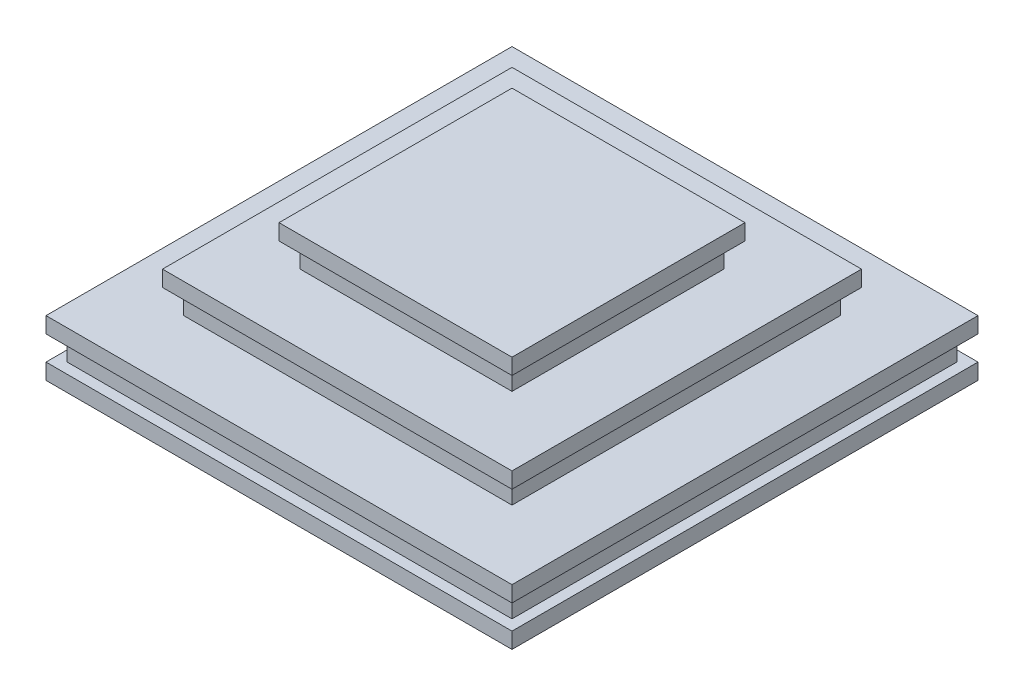
from build123d import *

# Parameters (mm, degrees)
SKETCH1_W           = 44
SKETCH1_H           = 44
BOSS_EXTRUDE1_DEPTH = 1.5
SKETCH1_3_W         = 42
SKETCH1_3_H         = 42
BOSS_EXTRUDE2_DEPTH = 3.8
BOSS_EXTRUDE3_START = 3.8
SKETCH1_5_W         = 44
SKETCH1_5_H         = 44
BOSS_EXTRUDE3_DEPTH = 1.5
BOSS_EXTRUDE4_START = 5.3
SKETCH1_6_W         = 31
SKETCH1_6_H         = 31
BOSS_EXTRUDE4_DEPTH = 2.3
BOSS_EXTRUDE5_START = 7.6
SKETCH1_7_W         = 33
SKETCH1_7_H         = 33
BOSS_EXTRUDE5_DEPTH = 1.5
BOSS_EXTRUDE6_START = 9.1
SKETCH1_8_W         = 20
SKETCH1_8_H         = 20
BOSS_EXTRUDE6_DEPTH = 2.3
BOSS_EXTRUDE7_START = 12.9
SKETCH1_12_W        = 22
SKETCH1_12_H        = 22
BOSS_EXTRUDE7_DEPTH = 1.5


with BuildPart() as part:
    # Sketch1 → Boss-Extrude1 (new body)
    with BuildSketch(Plane(origin=(0, 0, 0), x_dir=(1, 0, 0), z_dir=(0, 1, 0))):
        Rectangle(SKETCH1_W, SKETCH1_H)
    extrude(amount=BOSS_EXTRUDE1_DEPTH)

    # Sketch1<3> → Boss-Extrude2 (add)
    with BuildSketch(Plane(origin=(0, 0, 0), x_dir=(1, 0, 0), z_dir=(0, 1, 0))):
        Rectangle(SKETCH1_3_W, SKETCH1_3_H)
    extrude(amount=BOSS_EXTRUDE2_DEPTH)

    # Sketch1<5> → Boss-Extrude3 (add)
    with BuildSketch(Plane(origin=(0, 0, 0), x_dir=(1, 0, 0), z_dir=(0, 1, 0)).offset(BOSS_EXTRUDE3_START)):
        Rectangle(SKETCH1_5_W, SKETCH1_5_H)
    extrude(amount=BOSS_EXTRUDE3_DEPTH)

    # Sketch1<6> → Boss-Extrude4 (add)
    with BuildSketch(Plane(origin=(0, 0, 0), x_dir=(1, 0, 0), z_dir=(0, 1, 0)).offset(BOSS_EXTRUDE4_START)):
        Rectangle(SKETCH1_6_W, SKETCH1_6_H)
    extrude(amount=BOSS_EXTRUDE4_DEPTH)

    # Sketch1<7> → Boss-Extrude5 (add)
    with BuildSketch(Plane(origin=(0, 0, 0), x_dir=(1, 0, 0), z_dir=(0, 1, 0)).offset(BOSS_EXTRUDE5_START)):
        Rectangle(SKETCH1_7_W, SKETCH1_7_H)
    extrude(amount=BOSS_EXTRUDE5_DEPTH)

    # Sketch1<8> → Boss-Extrude6 (add)
    with BuildSketch(Plane(origin=(0, 0, 0), x_dir=(1, 0, 0), z_dir=(0, 1, 0)).offset(BOSS_EXTRUDE6_START)):
        Rectangle(SKETCH1_8_W, SKETCH1_8_H)
    extrude(amount=BOSS_EXTRUDE6_DEPTH)

    # Sketch1<12> → Boss-Extrude7 (add)
    with BuildSketch(Plane(origin=(0, 0, 0), x_dir=(1, 0, 0), z_dir=(0, 1, 0)).offset(BOSS_EXTRUDE7_START)):
        Rectangle(SKETCH1_12_W, SKETCH1_12_H)
    extrude(amount=-BOSS_EXTRUDE7_DEPTH)


solid = part.part
